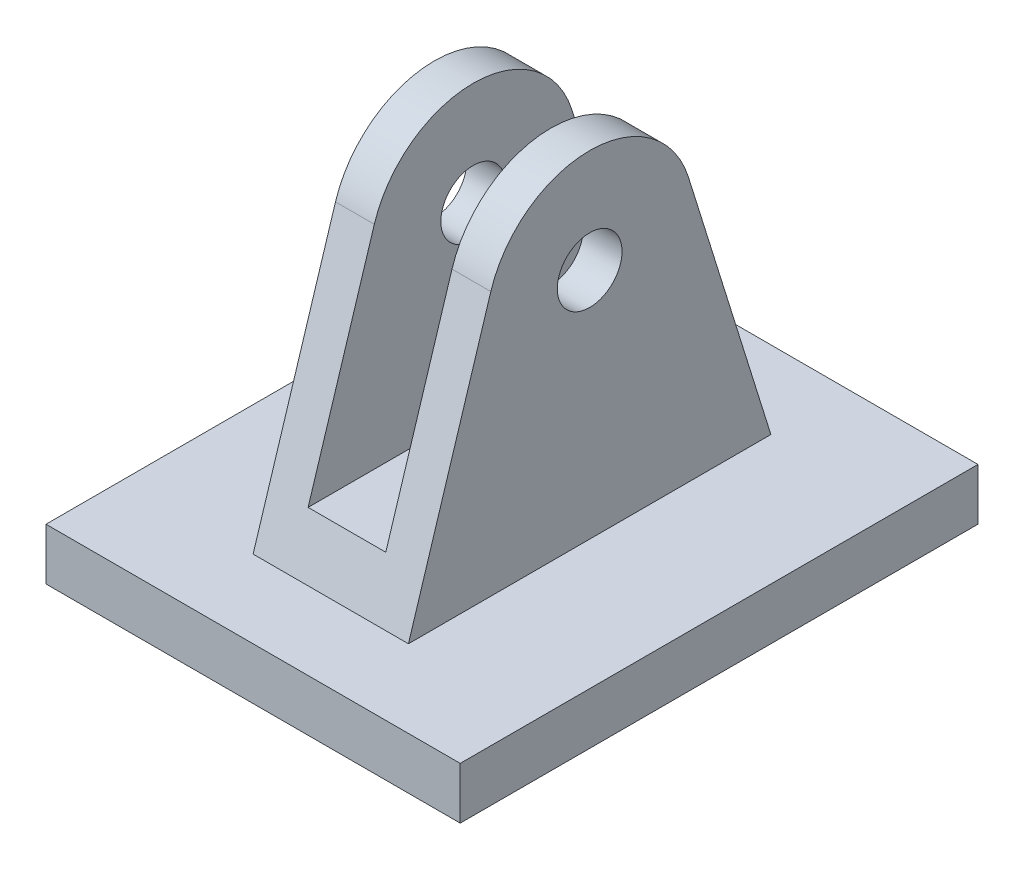
from build123d import *

# Parameters (mm, degrees)
SKETCH1_W               = 80
SKETCH1_H               = 100
BOSS_EXTRUDE1_DEPTH     = 10
SKETCH2_R               = 6.25
BOSS_EXTRUDE2_DEPTH     = 15
CUT_EXTRUDE1_DEPTH      = 99.615414617
CUT_EXTRUDE1_DEPTH_BACK = 99.615414617
SKETCH3_W               = 15
SKETCH3_H               = 55


with BuildPart() as part:
    # Sketch1 → Boss-Extrude1 (new body)
    with BuildSketch(Plane(origin=(0, 0, 0), x_dir=(1, 0, 0), z_dir=(0, 1, 0))):
        Rectangle(SKETCH1_W, SKETCH1_H)
    extrude(amount=BOSS_EXTRUDE1_DEPTH)

    # Sketch2 → Boss-Extrude2 (add, symmetric)
    with BuildSketch(Plane(origin=(0, 0, 0), x_dir=(0, 0, -1), z_dir=(1, 0, 0))):
        with BuildLine():
            Line((-35, 10), (-19.091339118, 60.959930425))
            ThreePointArc((-19.091339118, 60.959930425), (0, 75), (19.091339118, 60.959930425))
            Line((19.091339118, 60.959930425), (35, 10))
            Line((35, 10), (-35, 10))
        make_face()
        with Locations((0, 55)):
            Circle(SKETCH2_R, mode=Mode.SUBTRACT)
    extrude(amount=BOSS_EXTRUDE2_DEPTH, both=True)

    # Sketch3 → Cut-Extrude1 (cut, two sides: drawn at the far end of the back side and taken through both)
    with BuildSketch(Plane.XY.offset(-CUT_EXTRUDE1_DEPTH_BACK)):
        with Locations((0, 47.5)):
            Rectangle(SKETCH3_W, SKETCH3_H)
    extrude(amount=CUT_EXTRUDE1_DEPTH + CUT_EXTRUDE1_DEPTH_BACK, mode=Mode.SUBTRACT)


solid = part.part
